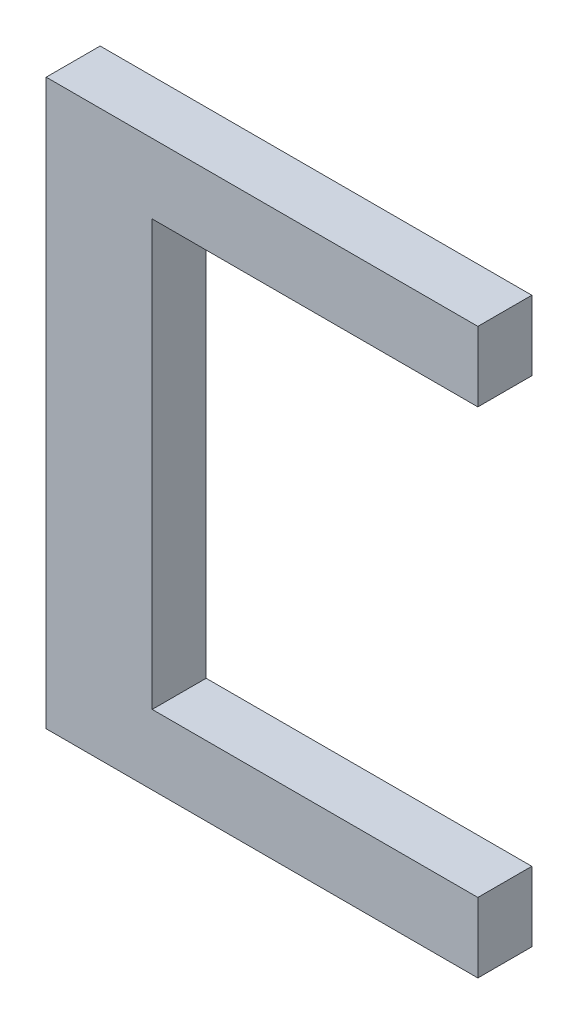
from build123d import *

# Parameters (mm, degrees)
BOSS_EXTRUDE1_DEPTH = 3


with BuildPart() as part:
    # Sketch1 → Boss-Extrude1 (new body)
    with BuildSketch(Plane.XY):
        Polygon((24.0041, 31.382), (0, 31.382), (0, 0), (24.0041, 0), (24.0041, 3.88), (5.895, 3.88), (5.895, 27.502), (24.0041, 27.502), align=None)
    extrude(amount=BOSS_EXTRUDE1_DEPTH)


solid = part.part
